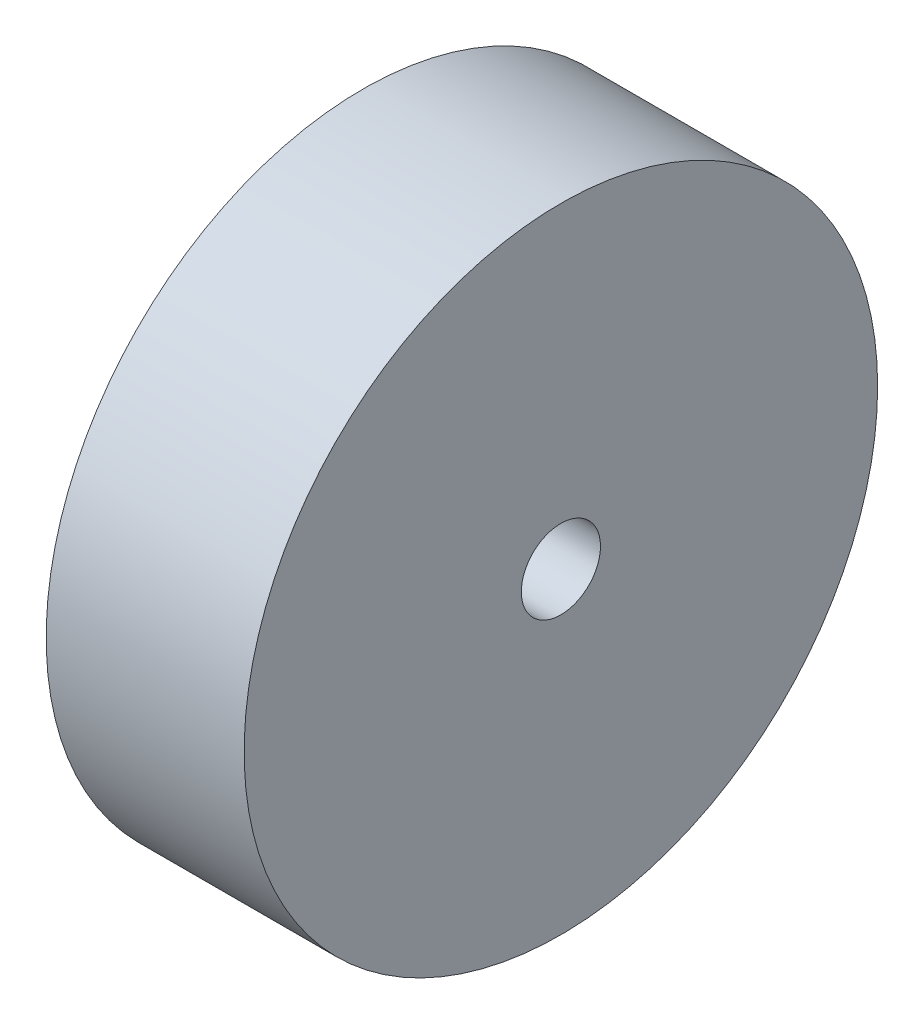
from build123d import *


with BuildPart() as part:
    # Esboço3 → Revolução1 (revolve)
    with BuildSketch(Plane.XY, mode=Mode.PRIVATE) as revolu_o1_sk:
        Polygon((0, 16), (0, 2), (-8, 2), (-8, 0), (-10, 0), (-10, 5), (-2, 5), (-2, 10), (-10, 10), (-10, 16), align=None)
    revolve(revolu_o1_sk.sketch.rotate(Axis((0, 0, 0), (-1, 0, 0)), 90), axis=Axis((0, 0, 0), (-1, 0, 0)))


solid = part.part
